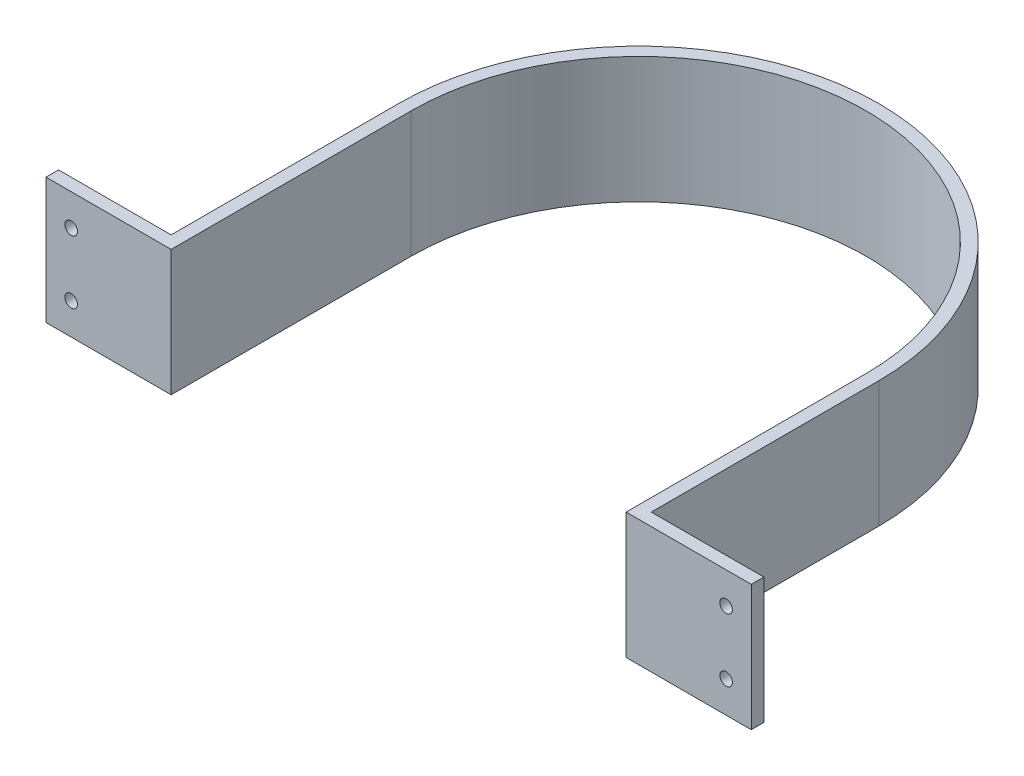
from build123d import *

# Parameters (mm, degrees)
BOSS_EXTRUDE1_DEPTH = 31.75
SKETCH3_R           = 3.175
CUT_EXTRUDE2_DEPTH  = 6.35


with BuildPart() as part:
    # Sketch1 → Boss-Extrude1 (new, symmetric)
    with BuildSketch(Plane(origin=(0, 0, 0), x_dir=(1, 0, 0), z_dir=(0, 1, 0))):
        with BuildLine():
            Line((-114.7, -121.05), (-114.7, 0))
            ThreePointArc((-114.7, 0), (0, 114.7), (114.7, 0))
            Line((114.7, 0), (114.7, -121.05))
            Line((114.7, -121.05), (177.8, -121.05))
            Line((177.8, -121.05), (177.8, -114.7))
            Line((177.8, -114.7), (121.05, -114.7))
            Line((121.05, -114.7), (121.05, 0))
            ThreePointArc((121.05, 0), (0, 121.05), (-121.05, 0))
            Line((-121.05, 0), (-121.05, -12.7))
            Line((-121.05, -12.7), (-121.05, -114.7))
            Line((-121.05, -114.7), (-177.8, -114.7))
            Line((-177.8, -114.7), (-177.8, -121.05))
            Line((-177.8, -121.05), (-114.7, -121.05))
        make_face()
    extrude(amount=BOSS_EXTRUDE1_DEPTH, both=True)

    # Sketch3 → Cut-Extrude2 (cut)
    with BuildSketch(Plane.XY.offset(121.05)):
        with Locations((-165.1, 15.875)):
            Circle(SKETCH3_R)
        with Locations((-165.1, -15.875)):
            Circle(SKETCH3_R)
        with Locations((165.1, -15.875)):
            Circle(SKETCH3_R)
        with Locations((165.1, 15.875)):
            Circle(SKETCH3_R)
    extrude(amount=-CUT_EXTRUDE2_DEPTH, mode=Mode.SUBTRACT)


solid = part.part
